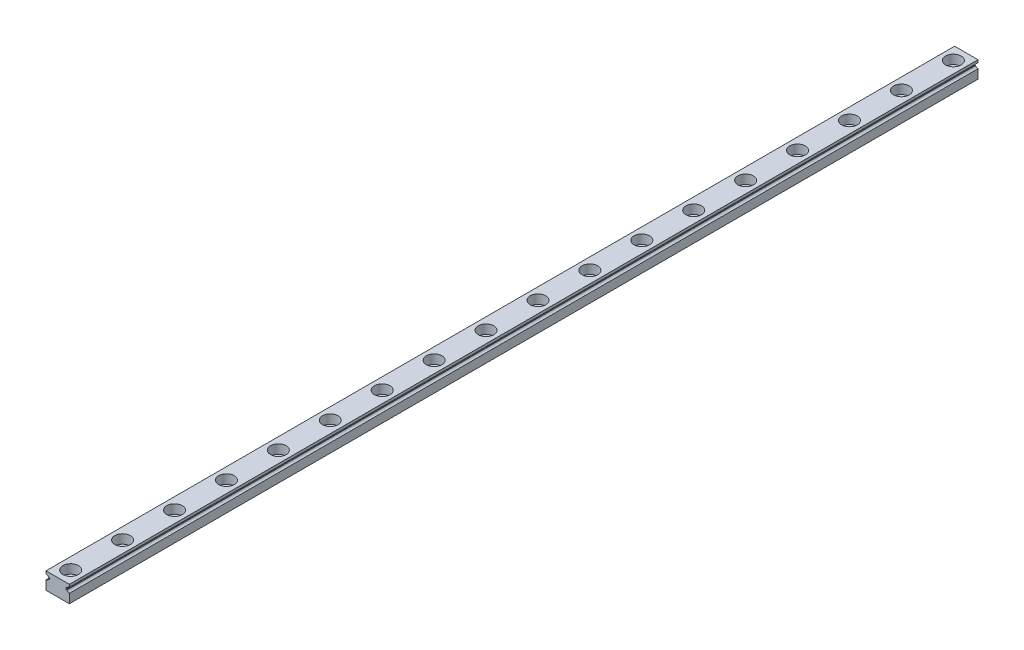
from build123d import *

# Parameters (mm, degrees)
EXTRUDE1_DEPTH  = 350
SKETCH2_R       = 3
EXTRUDE2_DEPTH  = 3.5
SKETCH_R        = 1.75
EXTRUDE3_DEPTH  = 351.089274329
LPATTERN1_COUNT = 18
LPATTERN1_PITCH = 20


with BuildPart() as part:
    # Sketch1 → Extrude1 (new body)
    with BuildSketch(Plane.XY):
        with BuildLine():
            Line((-4.5, -3.25), (4.5, -3.25))
            Line((4.5, -3.25), (4.5, 0.25))
            ThreePointArc((4.5, 0.25), (3.93077967, 0.427814974), (3.563991137, 0.898023568))
            Line((3.563991137, 0.898023568), (3.235073025, 0.898023568))
            Line((3.235073025, 0.898023568), (3.235073025, 1.601976432))
            Line((3.235073025, 1.601976432), (3.563991137, 1.601976432))
            ThreePointArc((3.563991137, 1.601976432), (3.93077967, 2.072185026), (4.5, 2.25))
            Line((4.5, 2.25), (4.5, 3.25))
            Line((4.5, 3.25), (-4.5, 3.25))
            Line((-4.5, 3.25), (-4.5, 2.25))
            ThreePointArc((-4.5, 2.25), (-3.93077967, 2.072185026), (-3.563991137, 1.601976432))
            Line((-3.563991137, 1.601976432), (-3.235073025, 1.601976432))
            Line((-3.235073025, 1.601976432), (-3.235073025, 0.898023568))
            Line((-3.235073025, 0.898023568), (-3.563991137, 0.898023568))
            ThreePointArc((-3.563991137, 0.898023568), (-3.93077967, 0.427814974), (-4.5, 0.25))
            Line((-4.5, 0.25), (-4.5, -3.25))
        make_face()
    extrude(amount=EXTRUDE1_DEPTH)

    # Sketch2 → Extrude2 (cut)
    with BuildSketch(Plane(origin=(0, 3.25, 0), x_dir=(1, 0, 0), z_dir=(0, 1, 0))):
        with Locations((0, -5)):
            Circle(SKETCH2_R)
    extrude2 = extrude(amount=-EXTRUDE2_DEPTH, mode=Mode.SUBTRACT)

    # Sketch → Extrude3 (cut, through all)
    with BuildSketch(Plane(origin=(0, 3.25, 0), x_dir=(1, 0, 0), z_dir=(0, 1, 0))):
        with Locations((0, -5)):
            Circle(SKETCH_R)
    extrude3 = extrude(amount=-EXTRUDE3_DEPTH, mode=Mode.SUBTRACT)

    # LPattern1: Extrude2, Extrude3 ×18
    with Locations(*[(0, 0, i * LPATTERN1_PITCH) for i in range(1, LPATTERN1_COUNT)]):
        add(extrude2, mode=Mode.SUBTRACT)
        add(extrude3, mode=Mode.SUBTRACT)


solid = part.part
